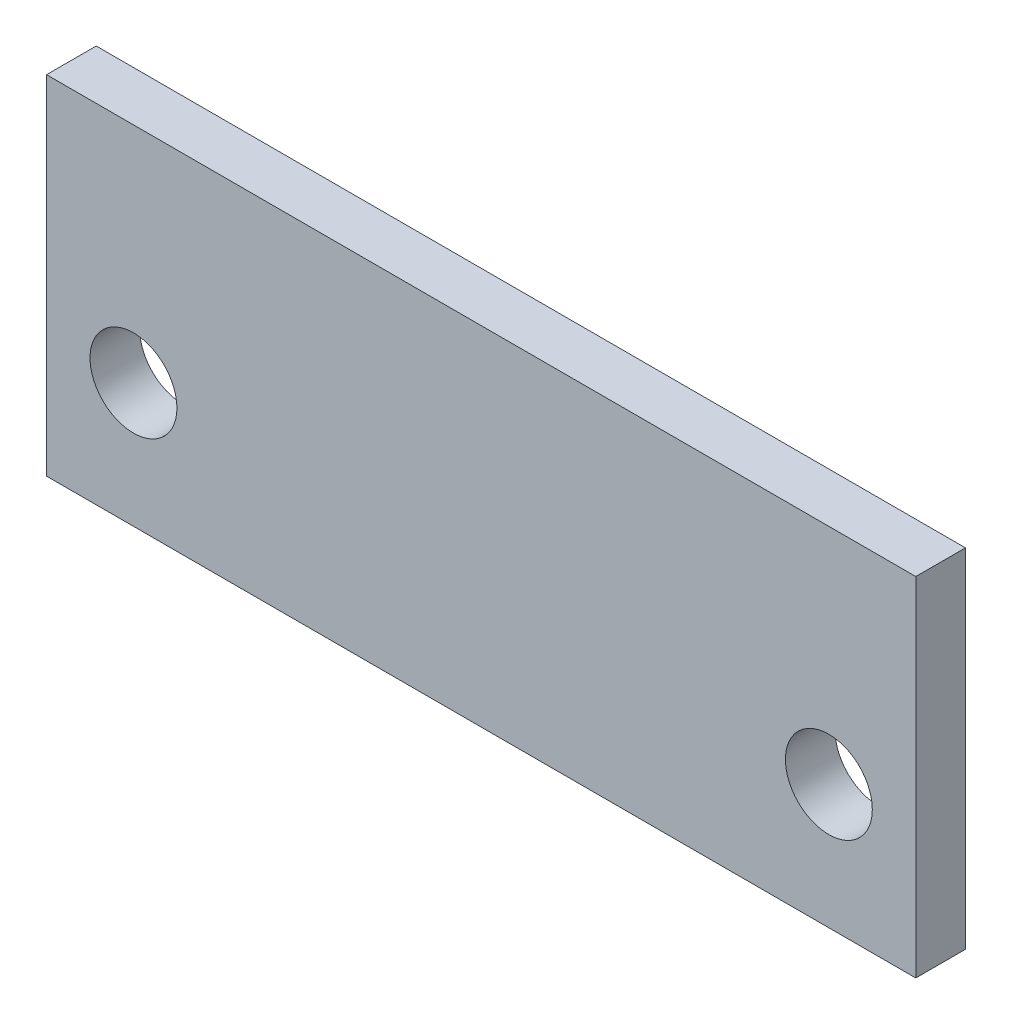
from build123d import *

# Parameters (mm, degrees)
SKETCH1_W           = 35
SKETCH1_H           = 2
BOSS_EXTRUDE1_DEPTH = 14
SKETCH2_R           = 1.75
CUT_EXTRUDE1_DEPTH  = 14


with BuildPart() as part:
    # Sketch1 → Boss-Extrude1 (new body)
    with BuildSketch(Plane(origin=(0, 0, 0), x_dir=(1, 0, 0), z_dir=(0, 1, 0))):
        Rectangle(SKETCH1_W, SKETCH1_H)
    extrude(amount=BOSS_EXTRUDE1_DEPTH)

    # Sketch2 → Cut-Extrude1 (cut)
    with BuildSketch(Plane.XY.offset(1)):
        with Locations((-14, 5)):
            Circle(SKETCH2_R)
        with Locations((14, 5)):
            Circle(SKETCH2_R)
    extrude(amount=-CUT_EXTRUDE1_DEPTH, mode=Mode.SUBTRACT)


solid = part.part
